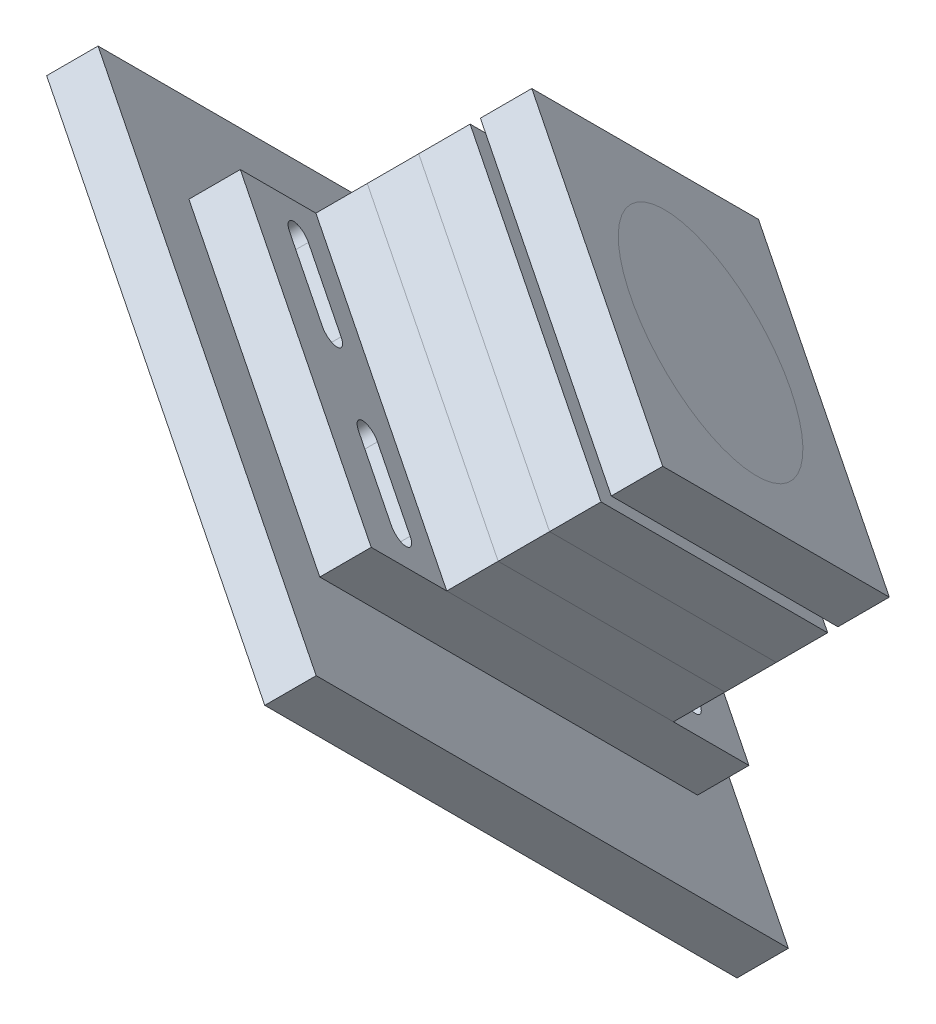
from build123d import *

# Parameters (mm, degrees)
SKETCH1_W           = 80
SKETCH1_H           = 80
BOSS_EXTRUDE1_DEPTH = 80
SKETCH2_R           = 97.950709898
CUT_EXTRUDE1_DEPTH  = 93.37604307
SKETCH3_R           = 78.302577254
SKETCH3_R_2         = 12.7
CUT_EXTRUDE2_DEPTH  = 40
SKETCH4_R           = 14.105721121
CUT_EXTRUDE3_DEPTH  = 40
SKETCH6_W           = 36
SKETCH6_H           = 36
BOSS_EXTRUDE2_DEPTH = 5
BOSS_EXTRUDE3_DEPTH = 5
BOSS_EXTRUDE4_DEPTH = 5
SKETCH12_R          = 12.7
BOSS_EXTRUDE6_DEPTH = 5
SKETCH15_W          = 36
SKETCH15_H          = 60
BOSS_EXTRUDE8_DEPTH = 5
SKETCH16_W          = 60
SKETCH16_H          = 75
BOSS_EXTRUDE9_DEPTH = 5


with BuildPart() as part:
    # Sketch1 → Boss-Extrude1 (new body)
    with BuildSketch(Plane(origin=(0, 0, 0), x_dir=(1, 0, 0), z_dir=(0, 1, 0))):
        with Locations((40, 40)):
            Rectangle(SKETCH1_W, SKETCH1_H)
    extrude(amount=BOSS_EXTRUDE1_DEPTH)

    # Sketch2 → Cut-Extrude1 (cut, through all)
    with BuildSketch(Plane(origin=(26.666666667, 26.666666667, -26.666666667), x_dir=(-0.8164965809277261, 0.408248290463863, -0.408248290463863), z_dir=(0.5773502691896257, 0.5773502691896258, -0.5773502691896258))):
        Circle(SKETCH2_R)
    extrude(amount=CUT_EXTRUDE1_DEPTH, mode=Mode.SUBTRACT)

    # Sketch3 → Cut-Extrude2 (cut)
    with BuildSketch(Plane(origin=(26.666666667, 26.666666667, -26.666666667), x_dir=(-0.4082482904638628, -0.408248290463863, -0.8164965809277263), z_dir=(0.5773502691896258, 0.577350269189626, -0.5773502691896256))):
        Circle(SKETCH3_R)
        with Locations(Location((0, 0, 0), (0, 0, 90))):
            Circle(SKETCH3_R_2, mode=Mode.SUBTRACT)
    extrude(amount=-CUT_EXTRUDE2_DEPTH, mode=Mode.SUBTRACT)

    # Sketch4 → Cut-Extrude3 (cut)
    with BuildSketch(Plane(origin=(11.547005384, 11.547005384, -11.547005384), x_dir=(-0.816496580927726, 0.408248290463863, -0.408248290463863), z_dir=(0.5773502691896258, 0.5773502691896262, -0.5773502691896255))):
        Circle(SKETCH4_R)
    extrude(amount=CUT_EXTRUDE3_DEPTH, mode=Mode.SUBTRACT)


with BuildPart() as body_2:
    # Sketch6 → Boss-Extrude2 (new body)
    with BuildSketch(Plane(origin=(8.082903769, 8.082903769, -8.082903769), x_dir=(0.8164965809277259, -0.4082482904638634, 0.40824829046386296), z_dir=(0.577350269189626, 0.5773502691896261, -0.5773502691896253))):
        Rectangle(SKETCH6_W, SKETCH6_H)
        with BuildLine():
            Line((11.839413643, -4.595463479), (-1.939918706, -12.55096472))
            ThreePointArc((-1.939918706, -12.55096472), (-6.35, -10.998522628), (-9.899494937, -7.955501241))
            Line((-9.899494937, -7.955501241), (-9.899494937, 7.955501241))
            ThreePointArc((-9.899494937, 7.955501241), (-6.35, 10.998522628), (-1.939918706, 12.55096472))
            Line((-1.939918706, 12.55096472), (11.839413643, 4.595463479))
            ThreePointArc((11.839413643, 4.595463479), (12.7, 0), (11.839413643, -4.595463479))
        make_face(mode=Mode.SUBTRACT)
    extrude(amount=-BOSS_EXTRUDE2_DEPTH)


with BuildPart() as body_3:
    # Sketch7 → Boss-Extrude3 (new body)
    with BuildSketch(Plane(origin=(5.196152423, 5.196152423, -5.196152423), x_dir=(0.4082482904638628, 0.40824829046386274, 0.8164965809277264), z_dir=(-0.5773502691896258, -0.5773502691896261, 0.5773502691896254))):
        Polygon((6.588457268, 24.588457268), (-24.588457268, 6.588457268), (-6.588457268, -24.588457268), (24.588457268, -6.588457268), align=None)
        with BuildLine():
            Line((6.363961031, 10.9904504), (6.363961031, -10.9904504))
            ThreePointArc((6.363961031, -10.9904504), (6.35, -10.998522628), (6.33602873, -11.006577121))
            Line((6.33602873, -11.006577121), (-12.699989761, -0.016126721))
            ThreePointArc((-12.699989761, -0.016126721), (-12.7, 0), (-12.699989761, 0.016126721))
            Line((-12.699989761, 0.016126721), (6.33602873, 11.006577121))
            ThreePointArc((6.33602873, 11.006577121), (6.35, 10.998522628), (6.363961031, 10.9904504))
        make_face(mode=Mode.SUBTRACT)
    extrude(amount=BOSS_EXTRUDE3_DEPTH)


with BuildPart() as body_4:
    # Sketch8 → Boss-Extrude4 (new body)
    with BuildSketch(Plane(origin=(2.309401077, 2.309401077, -2.309401077), x_dir=(0.40824829046386274, 0.4082482904638628, 0.8164965809277264), z_dir=(-0.5773502691896258, -0.5773502691896261, 0.5773502691896254))):
        Polygon((24.588457268, -6.588457268), (6.588457268, 24.588457268), (-24.588457268, 6.588457268), (-6.588457268, -24.588457268), align=None)
        Polygon((-5.656854249, 0), (2.828427125, 4.898979486), (2.828427125, -4.898979486), align=None, mode=Mode.SUBTRACT)
    extrude(amount=BOSS_EXTRUDE4_DEPTH)


with BuildPart() as body_5:
    # Sketch12 → Boss-Extrude6 (new body)
    with BuildSketch(Plane(origin=(11.547005384, 11.547005384, -11.547005384), x_dir=(-0.4082482904638629, -0.40824829046386285, -0.8164965809277264), z_dir=(0.577350269189626, 0.577350269189626, -0.5773502691896255))):
        Polygon((24.588457268, 6.588457268), (-6.588457268, 24.588457268), (-24.588457268, -6.588457268), (6.588457268, -24.588457268), align=None)
        with Locations(Location((0, 0, 0), (0, 0, 90))):
            Circle(SKETCH12_R, mode=Mode.SUBTRACT)
    extrude(amount=-BOSS_EXTRUDE6_DEPTH)


with BuildPart() as body_6:
    # Sketch15 → Boss-Extrude8 (new body)
    with BuildSketch(Plane(origin=(-0.577350269189621, -0.5773502691896211, 0.5773502691896204), x_dir=(-0.8164965809277259, 0.4082482904638634, -0.4082482904638631), z_dir=(-0.5773502691896261, -0.5773502691896256, 0.5773502691896257))):
        Rectangle(SKETCH15_W, SKETCH15_H)
        with BuildLine():
            Line((-14, 24.5), (-5, 24.5))
            ThreePointArc((-5, 24.5), (-3.5, 23), (-5, 21.5))
            Line((-5, 21.5), (-14, 21.5))
            ThreePointArc((-14, 21.5), (-15.5, 23), (-14, 24.5))
        make_face(mode=Mode.SUBTRACT)
        with BuildLine():
            Line((14, 24.5), (5, 24.5))
            ThreePointArc((5, 24.5), (3.5, 23), (5, 21.5))
            Line((5, 21.5), (14, 21.5))
            ThreePointArc((14, 21.5), (15.5, 23), (14, 24.5))
        make_face(mode=Mode.SUBTRACT)
        with BuildLine():
            Line((14, -24.5), (5, -24.5))
            ThreePointArc((5, -24.5), (3.5, -23), (5, -21.5))
            Line((5, -21.5), (14, -21.5))
            ThreePointArc((14, -21.5), (15.5, -23), (14, -24.5))
        make_face(mode=Mode.SUBTRACT)
        with BuildLine():
            Line((-14, -24.5), (-5, -24.5))
            ThreePointArc((-5, -24.5), (-3.5, -23), (-5, -21.5))
            Line((-5, -21.5), (-14, -21.5))
            ThreePointArc((-14, -21.5), (-15.5, -23), (-14, -24.5))
        make_face(mode=Mode.SUBTRACT)
    extrude(amount=BOSS_EXTRUDE8_DEPTH)


with BuildPart() as body_7:
    # Sketch16 → Boss-Extrude9 (new body)
    with BuildSketch(Plane(origin=(-3.464101615, -3.464101615, 3.464101615), x_dir=(-0.8164965809277259, 0.4082482904638634, -0.4082482904638631), z_dir=(-0.5773502691896261, -0.5773502691896256, 0.5773502691896257))):
        Rectangle(SKETCH16_W, SKETCH16_H)
        with BuildLine():
            Line((-11, 18.5), (-11, 27.5))
            ThreePointArc((-11, 27.5), (-9.5, 29), (-8, 27.5))
            Line((-8, 27.5), (-8, 18.5))
            ThreePointArc((-8, 18.5), (-9.5, 17), (-11, 18.5))
        make_face(mode=Mode.SUBTRACT)
        with BuildLine():
            Line((11, 18.5), (11, 27.5))
            ThreePointArc((11, 27.5), (9.5, 29), (8, 27.5))
            Line((8, 27.5), (8, 18.5))
            ThreePointArc((8, 18.5), (9.5, 17), (11, 18.5))
        make_face(mode=Mode.SUBTRACT)
        with BuildLine():
            Line((-11, -18.5), (-11, -27.5))
            ThreePointArc((-11, -27.5), (-9.5, -29), (-8, -27.5))
            Line((-8, -27.5), (-8, -18.5))
            ThreePointArc((-8, -18.5), (-9.5, -17), (-11, -18.5))
        make_face(mode=Mode.SUBTRACT)
        with BuildLine():
            Line((8, -27.5), (8, -18.5))
            ThreePointArc((8, -18.5), (9.5, -17), (11, -18.5))
            Line((11, -18.5), (11, -27.5))
            ThreePointArc((11, -27.5), (9.5, -29), (8, -27.5))
        make_face(mode=Mode.SUBTRACT)
    extrude(amount=BOSS_EXTRUDE9_DEPTH)


solid = Compound([part.part, body_2.part, body_3.part, body_4.part, body_5.part, body_6.part, body_7.part])
